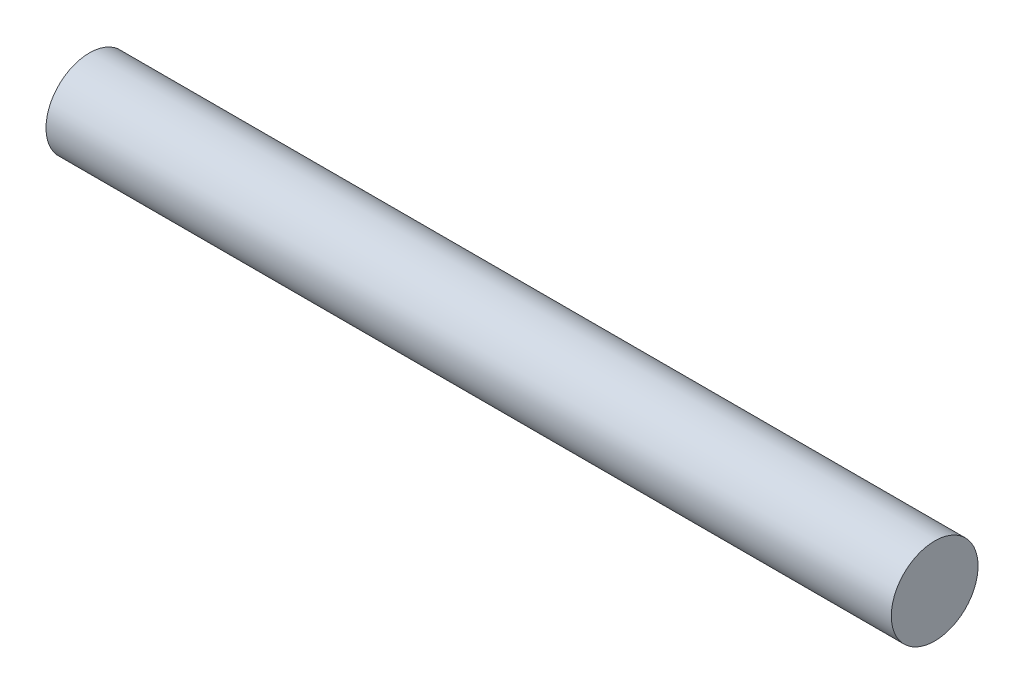
from build123d import *

# Parameters (mm, degrees)
SKETCH1_R           = 3.57
BOSS_EXTRUDE2_DEPTH = 69.54694372


with BuildPart() as part:
    # Sketch1 → Boss-Extrude2 (new body)
    with BuildSketch(Plane(origin=(0, 0, 0), x_dir=(0, 0, -1), z_dir=(1, 0, 0))):
        with Locations(Location((0, 0, 0), (0, 0, 180))):
            Circle(SKETCH1_R)
    extrude(amount=BOSS_EXTRUDE2_DEPTH)


solid = part.part
